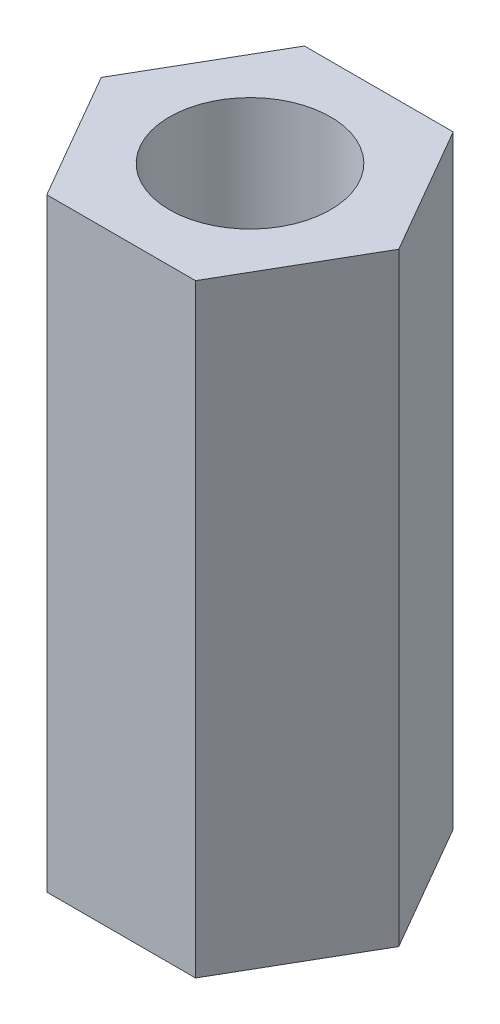
from build123d import *

# Parameters (mm, degrees)
SKETCH1_R           = 4
BOSS_EXTRUDE1_DEPTH = 30


with BuildPart() as part:
    # Sketch1 → Boss-Extrude1 (new body)
    with BuildSketch(Plane(origin=(0, 0, 0), x_dir=(1, 0, 0), z_dir=(0, 1, 0))):
        Polygon((2.764997208, 3.091769605), (-0.930044515, 9.491769605), (-8.320127961, 9.491769605), (-12.015169684, 3.091769605), (-8.320127961, -3.308230395), (-0.930044515, -3.308230395), align=None)
        with Locations(Location((-4.625086238, 3.091769605, 0), (0, 0, 270))):
            Circle(SKETCH1_R, mode=Mode.SUBTRACT)
    extrude(amount=BOSS_EXTRUDE1_DEPTH)


solid = part.part
